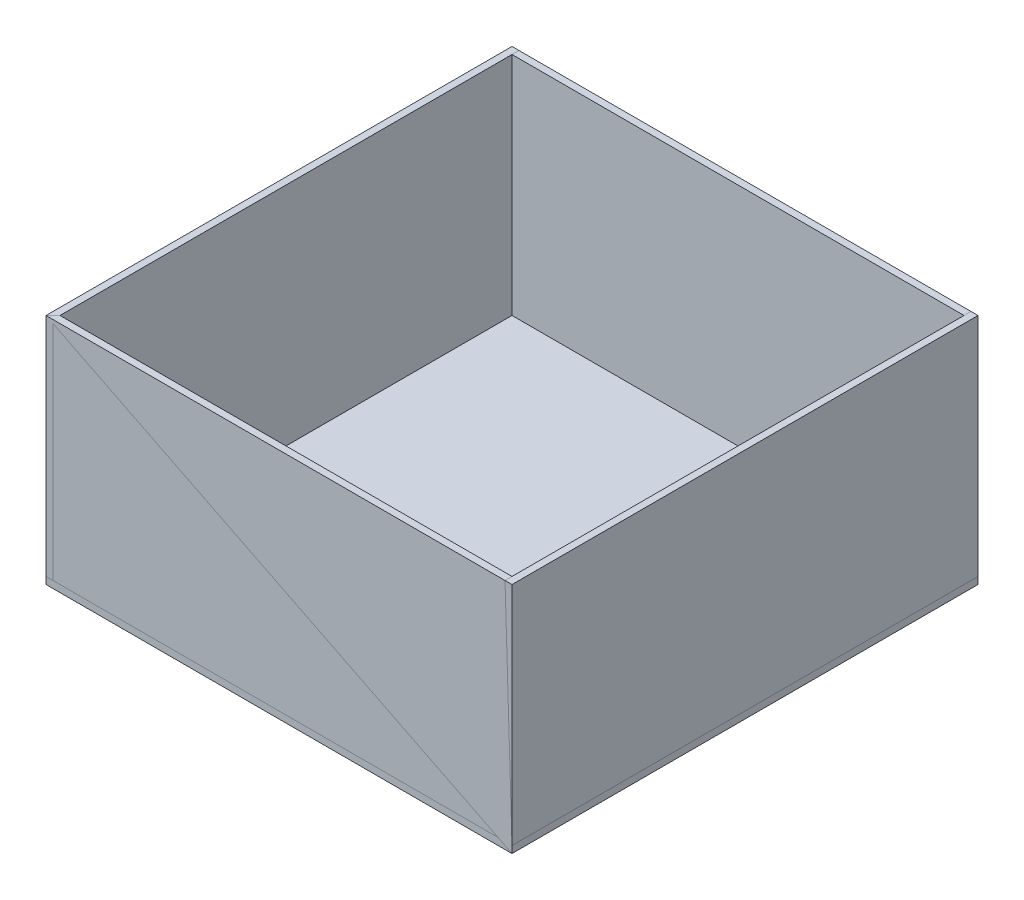
from build123d import *

# Parameters (mm, degrees)
SKETCH1_W             = 200
SKETCH1_H             = 200
BOSS_EXTRUDE1_DEPTH   = 100
SKETCH2_W             = 194
SKETCH2_H             = 194
CUT_EXTRUDE1_DEPTH    = 97
SKETCH3_W             = 200
SKETCH3_H             = 200
BOSS_EXTRUDE2_DEPTH   = 3
SKETCH4_W             = 3
SKETCH4_H             = 200
BOSS_EXTRUDE3_DEPTH   = 97
BOSS_EXTRUDE3_2_DEPTH = 97
SKETCH5_W             = 194
SKETCH5_H             = 3
BOSS_EXTRUDE4_DEPTH   = 97
BOSS_EXTRUDE4_2_DEPTH = 97


with BuildPart() as part:
    # Sketch1 → Boss-Extrude1 (new body)
    with BuildSketch(Plane(origin=(0, 0, 0), x_dir=(1, 0, 0), z_dir=(0, 1, 0))):
        Rectangle(SKETCH1_W, SKETCH1_H)
    extrude(amount=BOSS_EXTRUDE1_DEPTH)

    # Sketch2 → Cut-Extrude1 (cut)
    with BuildSketch(Plane(origin=(0, 100, 0), x_dir=(1, 0, 0), z_dir=(0, 1, 0))):
        Rectangle(SKETCH2_W, SKETCH2_H)
    extrude(amount=-CUT_EXTRUDE1_DEPTH, mode=Mode.SUBTRACT)


with BuildPart() as body_2:
    # Sketch3 → Boss-Extrude2 (new body)
    with BuildSketch(Plane.XZ):
        Rectangle(SKETCH3_W, SKETCH3_H)
    extrude(amount=-BOSS_EXTRUDE2_DEPTH)


with BuildPart() as body_3:
    # Sketch4 → Boss-Extrude3 (new body)
    with BuildSketch(Plane(origin=(0, 3, 0), x_dir=(1, 0, 0), z_dir=(0, 1, 0))):
        with Locations((-98.5, 0)):
            Rectangle(SKETCH4_W, SKETCH4_H)
    extrude(amount=BOSS_EXTRUDE3_DEPTH)


with BuildPart() as body_4:
    # Sketch4 → Boss-Extrude3 2 (new body)
    with BuildSketch(Plane(origin=(0, 3, 0), x_dir=(1, 0, 0), z_dir=(0, 1, 0))):
        with Locations((98.5, 0)):
            Rectangle(SKETCH4_W, SKETCH4_H)
    extrude(amount=BOSS_EXTRUDE3_2_DEPTH)


with BuildPart() as body_5:
    # Sketch5 → Boss-Extrude4 (new body)
    with BuildSketch(Plane(origin=(0, 3, 0), x_dir=(1, 0, 0), z_dir=(0, 1, 0))):
        with Locations((0, 98.5)):
            Rectangle(SKETCH5_W, SKETCH5_H)
    extrude(amount=BOSS_EXTRUDE4_DEPTH)


with BuildPart() as body_6:
    # Sketch5 → Boss-Extrude4 2 (new body)
    with BuildSketch(Plane(origin=(0, 3, 0), x_dir=(1, 0, 0), z_dir=(0, 1, 0))):
        with Locations((0, -98.5)):
            Rectangle(SKETCH5_W, SKETCH5_H)
    extrude(amount=BOSS_EXTRUDE4_2_DEPTH)


solid = Compound([part.part, body_2.part, body_3.part, body_4.part, body_5.part, body_6.part])
